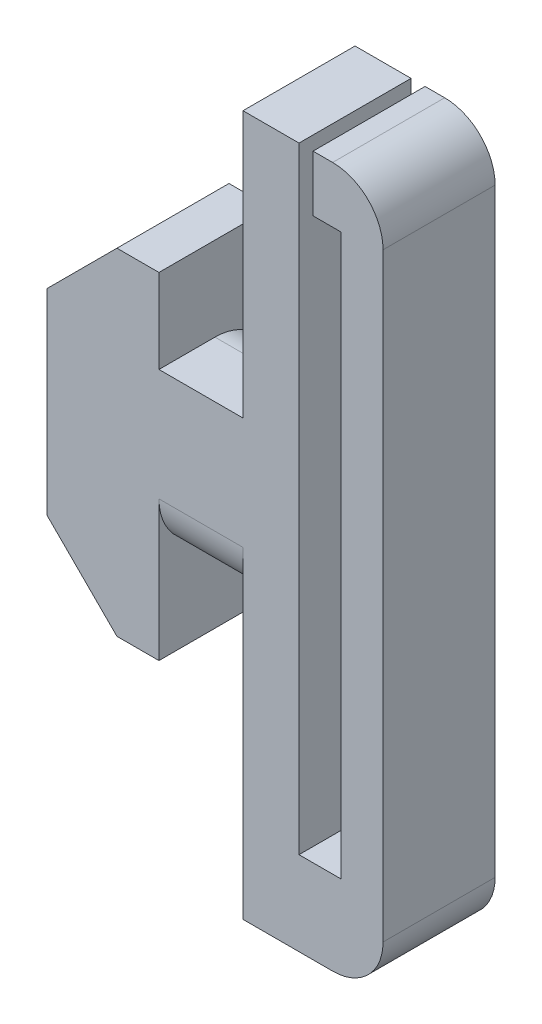
from build123d import *

# Parameters (mm, degrees)
DODANIE_WYCI_GNI_CIE1_DEPTH = 4
ZAOKR_GLENIE1_R             = 1.8
SZKIC2_W                    = 4
SZKIC2_H                    = 6
DODANIE_WYCI_GNI_CIE2_DEPTH = 3
ZAOKR_GLENIE2_R             = 2
SZKIC3_W                    = 4
SZKIC3_H                    = 12
DODANIE_WYCI_GNI_CIE3_DEPTH = 4
SFAZOWANIE1_SIZE            = 2.5


with BuildPart() as part:
    # Szkic1 → Dodanie-wyciągnięcie1 (new body)
    with BuildSketch(Plane.XY):
        Polygon((0, 0), (0, 25), (2, 25), (2, 3), (3.5, 3), (3.5, 23), (2.5, 23), (2.5, 25), (5, 25), (5, 0), align=None)
    extrude(amount=DODANIE_WYCI_GNI_CIE1_DEPTH)

    # Zaokrąglenie1
    zaokr_glenie1_edges = [part.edges().sort_by_distance(p)[0] for p in [
        (5, 25, 2),
        (5, 0, 2),
    ]]
    fillet(zaokr_glenie1_edges, radius=ZAOKR_GLENIE1_R)

    # Szkic2 → Dodanie-wyciągnięcie2 (add)
    with BuildSketch(Plane.ZY):
        with Locations((2, 12.5)):
            Rectangle(SZKIC2_W, SZKIC2_H)
    extrude(amount=DODANIE_WYCI_GNI_CIE2_DEPTH)

    # Zaokrąglenie2
    zaokr_glenie2_edges = [part.edges().sort_by_distance(p)[0] for p in [
        (-1.5, 15.5, 0),
        (-1.5, 9.5, 4),
    ]]
    fillet(zaokr_glenie2_edges, radius=ZAOKR_GLENIE2_R)

    # Szkic3 → Dodanie-wyciągnięcie3 (add)
    with BuildSketch(Plane.ZY.offset(3)):
        with Locations((2, 12.5)):
            Rectangle(SZKIC3_W, SZKIC3_H)
    extrude(amount=DODANIE_WYCI_GNI_CIE3_DEPTH)

    # Sfazowanie1
    sfazowanie1_edges = [part.edges().sort_by_distance(p)[0] for p in [
        (-7, 6.5, 2),
        (-7, 18.5, 2),
    ]]
    chamfer(sfazowanie1_edges, length=SFAZOWANIE1_SIZE)


solid = part.part
